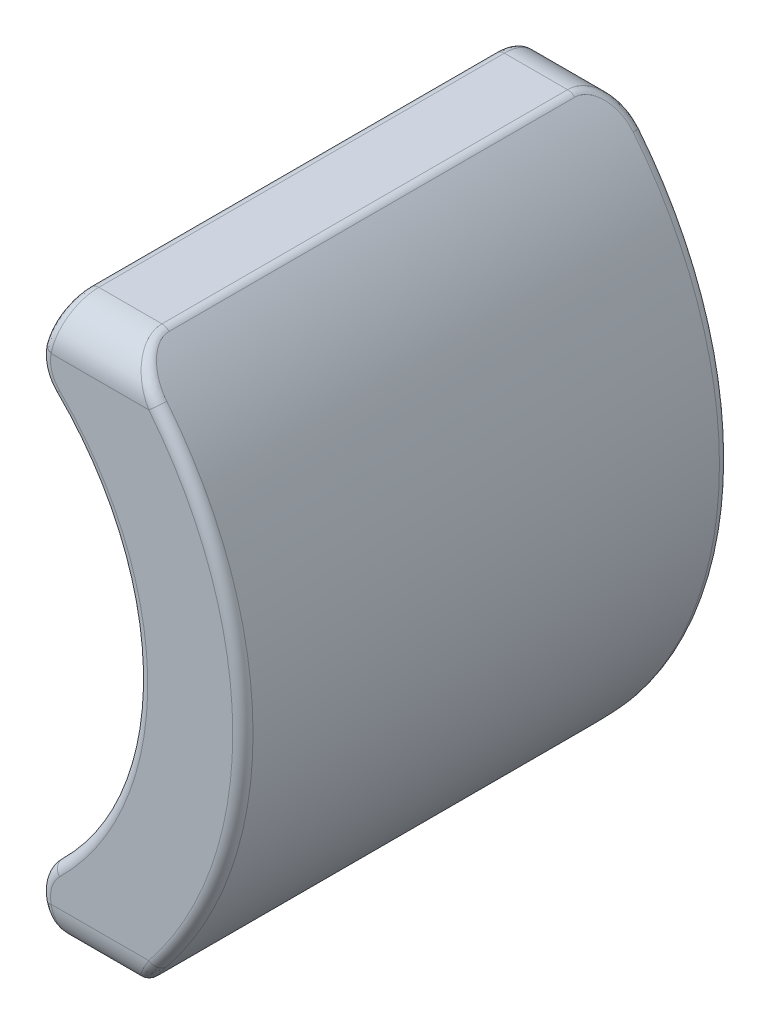
from build123d import *

# Parameters (mm, degrees)
BOSS_EXTRUDE1_DEPTH = 6
FILLET1_R           = 1
FILLET2_R           = 1
FILLET3_R           = 0.25


with BuildPart() as part:
    # Sketch1 → Boss-Extrude1 (new, symmetric)
    with BuildSketch(Plane.XY):
        with BuildLine():
            Line((6.738137725, -6.88), (4.878137725, -6.88))
            Line((4.878137725, -6.88), (4.531835438, -5.38))
            ThreePointArc((4.531835438, -5.38), (7.034339517, 0), (4.531835438, 5.38))
            Line((4.531835438, 5.38), (4.878137725, 6.88))
            Line((4.878137725, 6.88), (6.738137725, 6.88))
            ThreePointArc((6.738137725, 6.88), (9.63, 0), (6.738137725, -6.88))
        make_face()
    extrude(amount=BOSS_EXTRUDE1_DEPTH, both=True)

    # Fillet1
    fillet1_edges = [part.edges().sort_by_distance(p)[0] for p in [
        (4.531835438, 5.38, 0),
        (4.531835438, -5.38, 0),
    ]]
    fillet(fillet1_edges, radius=FILLET1_R)

    # Fillet2
    fillet2_edges = [part.edges().sort_by_distance(p)[0] for p in [
        (5.808137725, -6.88, -6),
        (5.808137725, 6.88, -6),
        (5.808137725, -6.88, 6),
        (5.808137725, 6.88, 6),
    ]]
    fillet(fillet2_edges, radius=FILLET2_R)

    # Fillet3
    fillet3_edges = [part.edges().sort_by_distance(p)[0] for p in [
        (7.034339517, 0, -6),
        (4.687877266, 5.411310183, -6),
        (7.034339517, 0, 6),
        (4.687877266, -5.411310183, 6),
        (6.738137725, -6.88, 0),
        (4.878137725, -6.88, 0),
        (9.63, 0, -6),
        (6.738137725, 6.88, 0),
        (9.63, 0, 6),
        (7.064336577, 6.544619807, 5.7471817),
        (7.064336577, -6.544619807, 5.7471817),
        (7.064336588, 6.544619821, -5.747181704),
        (7.064336589, -6.544619821, -5.747181705),
        (4.687877266, -5.411310183, -6),
        (4.655934776, -5.914769544, 5.99939535),
        (4.655934776, -5.914769544, -5.99939535),
        (4.815123489, -6.607055355, 5.686578845),
        (4.815123489, -6.607055355, -5.686578845),
        (4.878137725, 6.88, 0),
        (4.815123489, 6.607055355, 5.686578845),
        (4.815123489, 6.607055355, -5.686578845),
        (4.687877266, 5.411310183, 6),
        (4.655934772, 5.914769545, 5.999395357),
        (4.655934772, 5.914769545, -5.999395357),
    ]]
    fillet(fillet3_edges, radius=FILLET3_R)


solid = part.part
